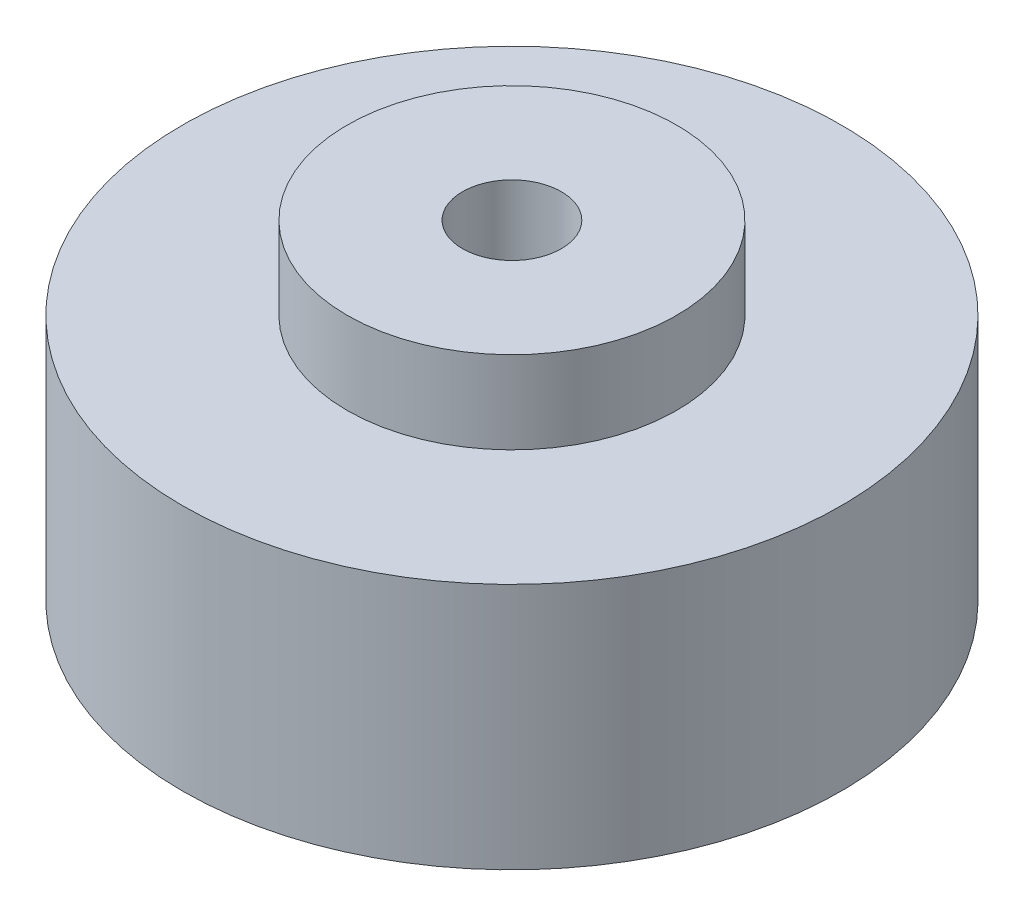
from build123d import *

# Parameters (mm, degrees)
SKETCH1_R          = 20
EXTRUDE1_DEPTH     = 15
SKETCH2_R          = 10
EXTRUDE2_DEPTH     = 5
SKETCH3_R          = 3
CUT_EXTRUDE1_DEPTH = 35.641016151


with BuildPart() as part:
    # Sketch1 → Extrude1 (new body)
    with BuildSketch(Plane(origin=(0, 0, 0), x_dir=(1, 0, 0), z_dir=(0, 1, 0))):
        with Locations(Location((0, 0, 0), (0, 0, 270))):
            Circle(SKETCH1_R)
    extrude(amount=-EXTRUDE1_DEPTH)

    # Sketch2 → Extrude2 (add)
    with BuildSketch(Plane(origin=(0, 0, 0), x_dir=(1, 0, 0), z_dir=(0, 1, 0))):
        with Locations(Location((0, 0, 0), (0, 0, 270))):
            Circle(SKETCH2_R)
    extrude(amount=EXTRUDE2_DEPTH)

    # Sketch3 → Cut-Extrude1 (cut, through all)
    with BuildSketch(Plane(origin=(0, 5, 0), x_dir=(1, 0, 0), z_dir=(0, 1, 0))):
        with Locations(Location((0, 0, 0), (0, 0, 270))):
            Circle(SKETCH3_R)
    extrude(amount=-CUT_EXTRUDE1_DEPTH, mode=Mode.SUBTRACT)


solid = part.part
